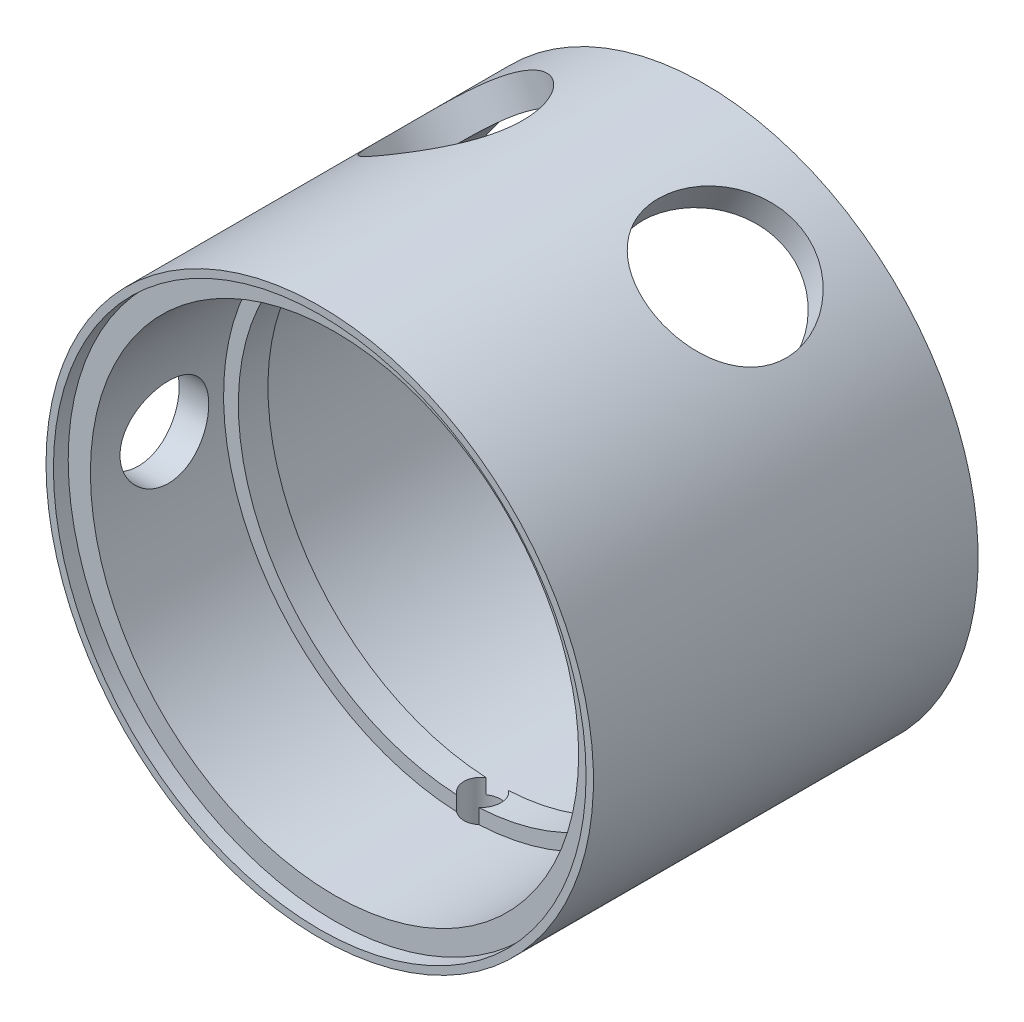
from build123d import *

# Parameters (mm, degrees)
SKETCH1_R           = 19
SKETCH1_R_2         = 13.5
BOSS_EXTRUDE1_DEPTH = 26
SKETCH2_W           = 26
SKETCH2_H           = 0.5
SKETCH4_R           = 5
CUT_EXTRUDE1_DEPTH  = 10
SKETCH5_R           = 1.25
CUT_EXTRUDE4_DEPTH  = 20
SKETCH6_R           = 3
CUT_EXTRUDE5_DEPTH  = 20


with BuildPart() as part:
    # Sketch1 → Boss-Extrude1 (new body)
    with BuildSketch(Plane.XY):
        with Locations(Location((0, 0, 0), (0, 0, 180))):
            Circle(SKETCH1_R)
        with Locations(Location((0, 0, 0), (0, 0, 180))):
            Circle(SKETCH1_R_2, mode=Mode.SUBTRACT)
    extrude(amount=BOSS_EXTRUDE1_DEPTH)

    # Sketch2 → Cut-Revolve1 (revolve, cut)
    with BuildSketch(Plane(origin=(0, 0, 0), x_dir=(0, 0, -1), z_dir=(1, 0, 0)), mode=Mode.PRIVATE) as cut_revolve1_sk:
        with Locations((-13, 18.75)):
            Rectangle(SKETCH2_W, SKETCH2_H)
    revolve(cut_revolve1_sk.sketch.rotate(Axis((0, 0, 0), (0, 0, 1)), 90), axis=Axis((0, 0, 0), (0, 0, 1)), mode=Mode.SUBTRACT)

    # Sketch3 → Cut-Revolve2 (revolve, cut)
    with BuildSketch(Plane(origin=(0, 0, 0), x_dir=(0, 0, -1), z_dir=(1, 0, 0)), mode=Mode.PRIVATE) as cut_revolve2_sk:
        Polygon((0, 18), (0, 0), (-26, 0), (-26, 18), (-25, 18), (-25, 16.5), (-16, 16.5), (-16, 15.5), (-14, 15.5), (-14, 16.5), (-1, 16.5), (-1, 18), align=None)
    revolve(cut_revolve2_sk.sketch.rotate(Axis((0, 0, 26), (0, 0, -1)), 90), axis=Axis((0, 0, 26), (0, 0, -1)), mode=Mode.SUBTRACT)

    # Sketch4 → Cut-Extrude1 (cut)
    with BuildSketch(Plane(origin=(9.25, 16.02146997, 0), x_dir=(-0.866025403784438, 0.500000000000001, 0), z_dir=(0.500000000000001, 0.866025403784438, 0))):
        with Locations((0, 7.7)):
            Circle(SKETCH4_R)
    cut_extrude1 = extrude(amount=-CUT_EXTRUDE1_DEPTH, mode=Mode.SUBTRACT)

    # Mirror1: Cut-Extrude1 across plane
    add(cut_extrude1.mirror(Plane(origin=(0, 0, 0), x_dir=(0, 0, 1), z_dir=(1, 0, 0))), mode=Mode.SUBTRACT)

    # Sketch5 → Cut-Extrude4 (cut)
    with BuildSketch(Plane(origin=(0, 0, 0), x_dir=(1, 0, 0), z_dir=(0, 1, 0))):
        with Locations(Location((0, -15, 0), (0, 0, 270))):
            Circle(SKETCH5_R)
    extrude(amount=-CUT_EXTRUDE4_DEPTH, mode=Mode.SUBTRACT)

    # Sketch6 → Cut-Extrude5 (cut)
    with BuildSketch(Plane(origin=(0, 0, 0), x_dir=(0, 0, -1), z_dir=(1, 0, 0))):
        with Locations((-20, 0)):
            Circle(SKETCH6_R)
    extrude(amount=-CUT_EXTRUDE5_DEPTH, mode=Mode.SUBTRACT)


solid = part.part
